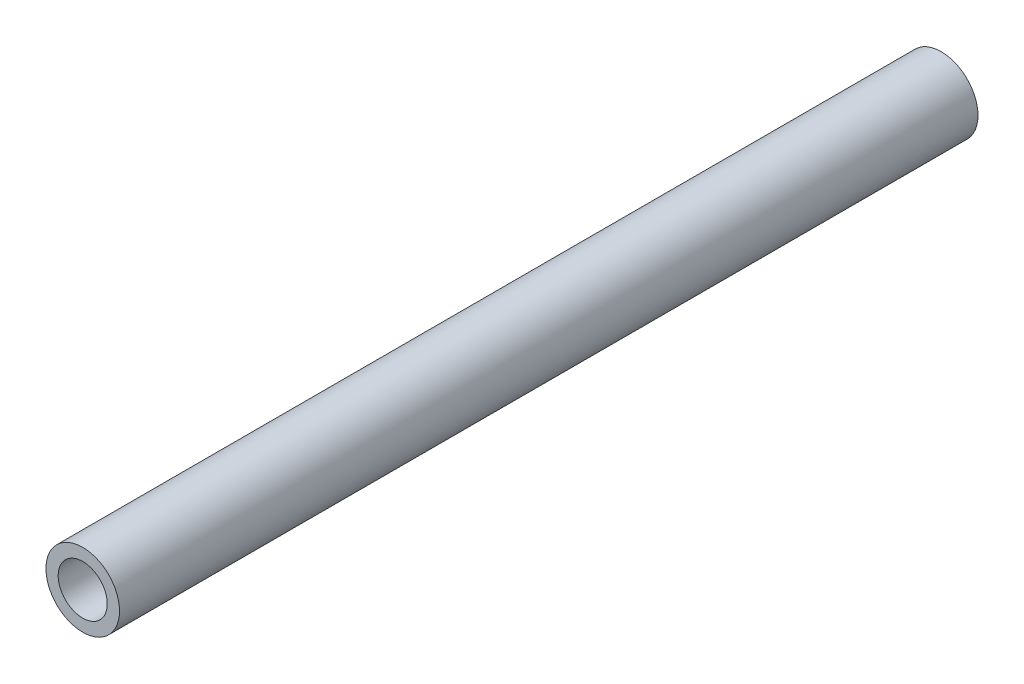
from build123d import *

# Parameters (mm, degrees)
SKETCH1_R           = 3
SKETCH1_R_2         = 2
BOSS_EXTRUDE1_DEPTH = 70


with BuildPart() as part:
    # Sketch1 → Boss-Extrude1 (new body)
    with BuildSketch(Plane.XY):
        Circle(SKETCH1_R)
        Circle(SKETCH1_R_2, mode=Mode.SUBTRACT)
    extrude(amount=BOSS_EXTRUDE1_DEPTH)


solid = part.part
